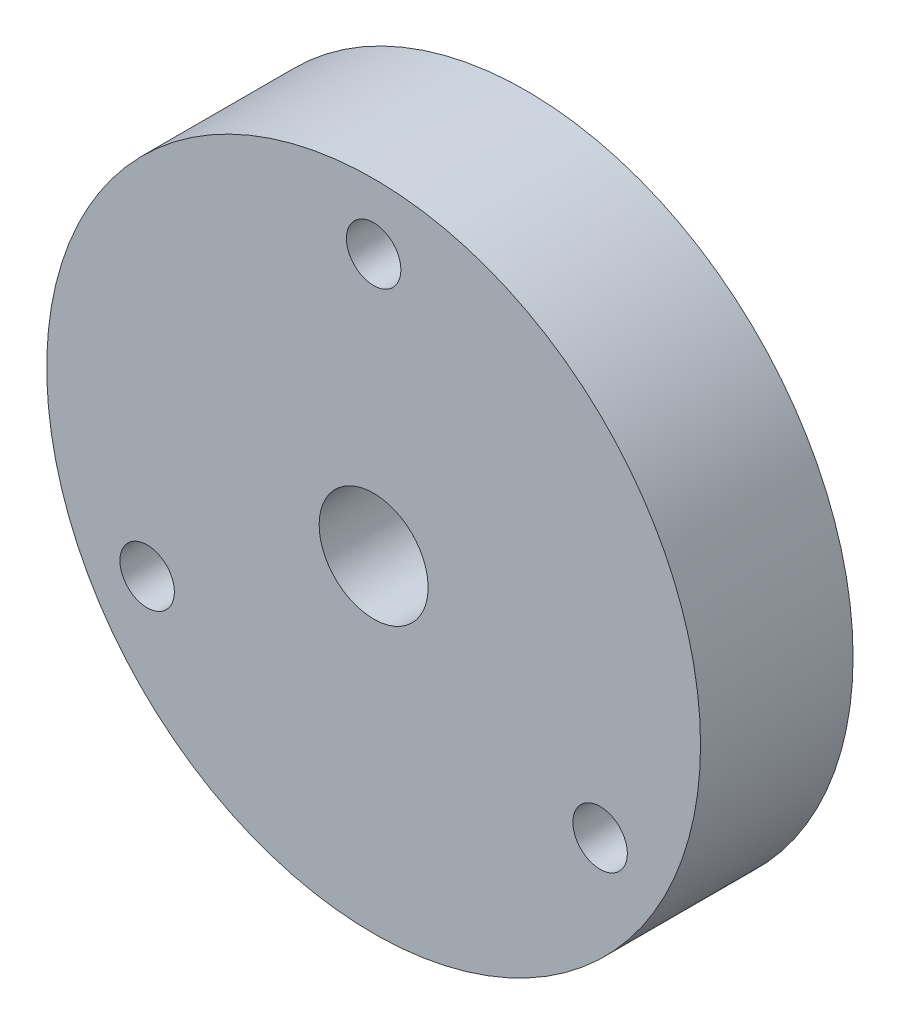
from build123d import *

# Parameters (mm, degrees)
SKETCH1_R           = 15
BOSS_EXTRUDE2_DEPTH = 7
SKETCH2_R           = 2.5
CUT_EXTRUDE1_DEPTH  = 7
SKETCH3_R           = 1.25
CUT_EXTRUDE2_DEPTH  = 23.338307904


with BuildPart() as part:
    # Sketch1 → Boss-Extrude2 (new body)
    with BuildSketch(Plane.XY):
        Circle(SKETCH1_R)
    extrude(amount=BOSS_EXTRUDE2_DEPTH)

    # Sketch2 → Cut-Extrude1 (cut)
    with BuildSketch(Plane(origin=(0, 0, 0), x_dir=(-1, 0, 0), z_dir=(0, 0, -1))):
        Circle(SKETCH2_R)
    extrude(amount=-CUT_EXTRUDE1_DEPTH, mode=Mode.SUBTRACT)

    # Sketch3 → Cut-Extrude2 (cut, through all)
    with BuildSketch(Plane.XY.offset(7)):
        with Locations((0, 12)):
            Circle(SKETCH3_R)
        with Locations((10.392304845, -6)):
            Circle(SKETCH3_R)
        with Locations((-10.392304845, -6)):
            Circle(SKETCH3_R)
    extrude(amount=-CUT_EXTRUDE2_DEPTH, mode=Mode.SUBTRACT)


solid = part.part
